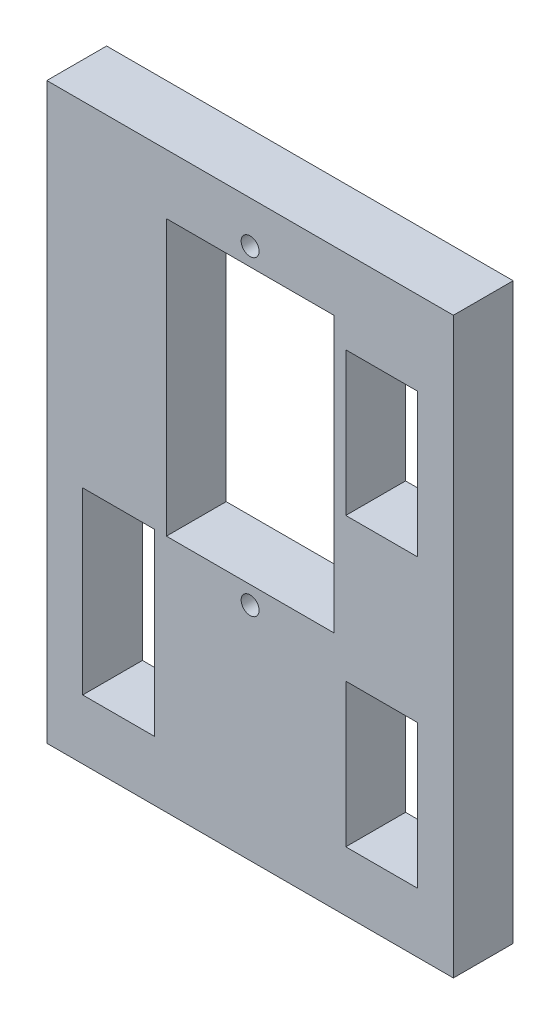
from build123d import *

# Parameters (mm, degrees)
CROQUIS1_W              = 34
CROQUIS1_H              = 48
CROQUIS1_R              = 0.75
CROQUIS1_W_2            = 14
CROQUIS1_H_2            = 23
CROQUIS1_W_3            = 6
CROQUIS1_H_3            = 12
CROQUIS1_H_4            = 15
SALIENTE_EXTRUIR1_DEPTH = 5


with BuildPart() as part:
    # Croquis1 → Saliente-Extruir1 (new body)
    with BuildSketch(Plane.XY):
        with Locations((17, 24)):
            Rectangle(CROQUIS1_W, CROQUIS1_H)
        with Locations((17, 18.5)):
            Circle(CROQUIS1_R, mode=Mode.SUBTRACT)
        with Locations((17, 44.5)):
            Circle(CROQUIS1_R, mode=Mode.SUBTRACT)
        with Locations((17, 31.5)):
            Rectangle(CROQUIS1_W_2, CROQUIS1_H_2, mode=Mode.SUBTRACT)
        with Locations((28, 11)):
            Rectangle(CROQUIS1_W_3, CROQUIS1_H_3, mode=Mode.SUBTRACT)
        with Locations((28, 35)):
            Rectangle(CROQUIS1_W_3, CROQUIS1_H_3, mode=Mode.SUBTRACT)
        with Locations((6, 12.5)):
            Rectangle(CROQUIS1_W_3, CROQUIS1_H_4, mode=Mode.SUBTRACT)
    extrude(amount=SALIENTE_EXTRUIR1_DEPTH)


solid = part.part
